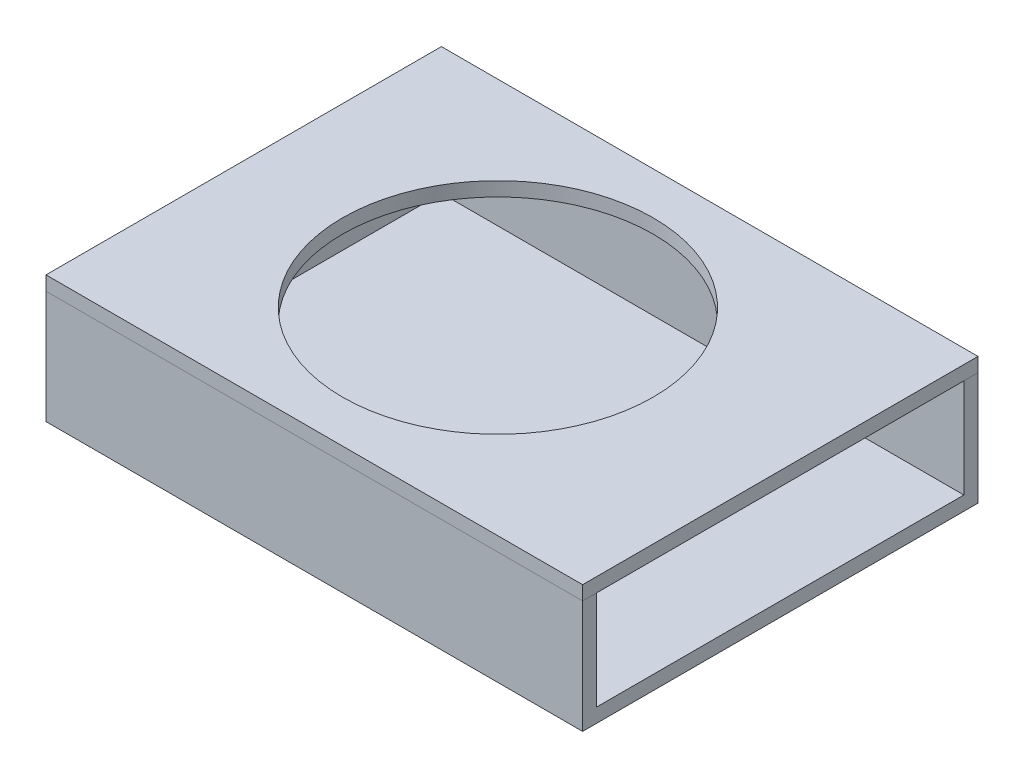
from build123d import *

# Parameters (mm, degrees)
SKETCH_1_W          = 38
SKETCH_1_H          = 28
EXTRUDE_1_DEPTH     = 8
CUT_EXTRUDE_START   = 1
SKETCH_2_W          = 37
SKETCH_2_H          = 26
CUT_EXTRUDE_1_DEPTH = 7
EXTRUDE_START       = 8
SKETCH_4_W          = 38
SKETCH_4_H          = 28
EXTRUDE_3_DEPTH     = 1
CUT_EXTRUDE_START_2 = 9
SKETCH_5_R          = 11
CUT_EXTRUDE_2_DEPTH = 1


with BuildPart() as part:
    # 스케치1 → 보스-돌출1 (new body)
    with BuildSketch(Plane(origin=(0, 0, 0), x_dir=(1, 0, 0), z_dir=(0, 1, 0))):
        Rectangle(SKETCH_1_W, SKETCH_1_H)
    extrude(amount=EXTRUDE_1_DEPTH)

    # 스케치2 → 컷-돌출1 (cut)
    with BuildSketch(Plane(origin=(0, 0, 0), x_dir=(1, 0, 0), z_dir=(0, 1, 0)).offset(CUT_EXTRUDE_START)):
        with Locations((0.5, 0)):
            Rectangle(SKETCH_2_W, SKETCH_2_H)
    extrude(amount=CUT_EXTRUDE_1_DEPTH, mode=Mode.SUBTRACT)


with BuildPart() as body_2:
    # 스케치4 → 보스-돌출3 (new body)
    with BuildSketch(Plane(origin=(0, 0, 0), x_dir=(1, 0, 0), z_dir=(0, 1, 0)).offset(EXTRUDE_START)):
        Rectangle(SKETCH_4_W, SKETCH_4_H)
    extrude(amount=EXTRUDE_3_DEPTH)

    # 스케치5 → 컷-돌출2 (cut)
    with BuildSketch(Plane(origin=(0, 0, 0), x_dir=(1, 0, 0), z_dir=(0, 1, 0)).offset(CUT_EXTRUDE_START_2)):
        with Locations(Location((-1, 0, 0), (0, 0, 270))):
            Circle(SKETCH_5_R)
    extrude(amount=-CUT_EXTRUDE_2_DEPTH, mode=Mode.SUBTRACT)


solid = Compound([part.part, body_2.part])
